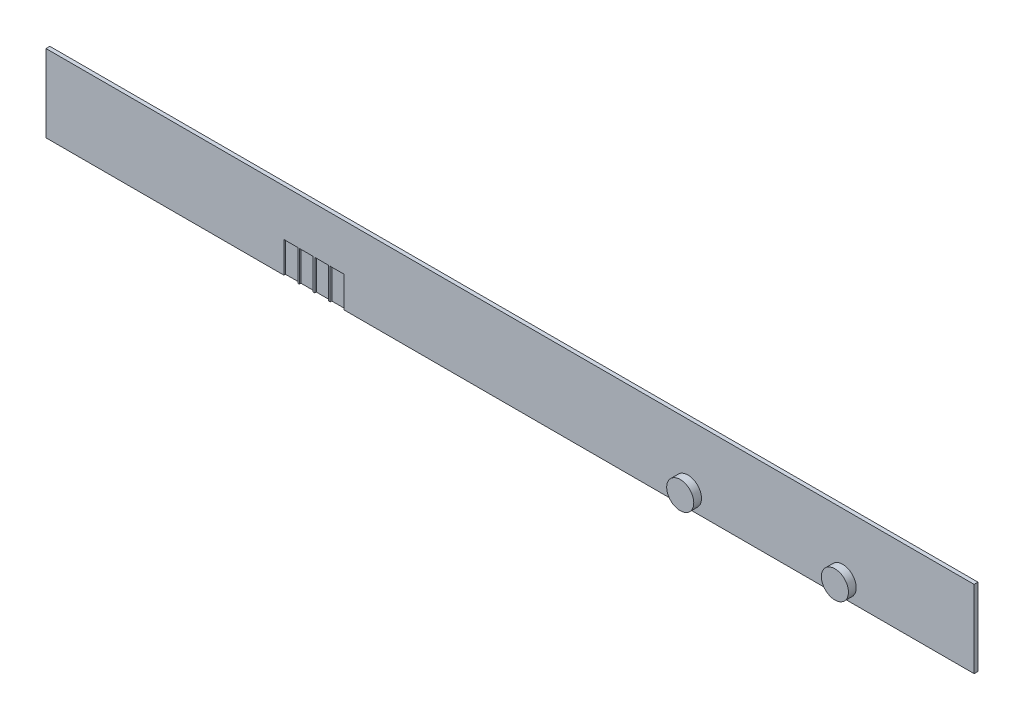
from build123d import *

# Parameters (mm, degrees)
SKETCH1_W           = 120
SKETCH1_H           = 10
BOSS_EXTRUDE1_DEPTH = 0.5
JACKS_R             = 1.75
BOSS_EXTRUDE2_DEPTH = 1
USB_PORT_W          = 1.8
USB_PORT_H          = 4
CUT_EXTRUDE2_DEPTH  = 0.2
LPATTERN1_COUNT     = 4
LPATTERN1_PITCH     = 2


with BuildPart() as part:
    # Sketch1 → Boss-Extrude1 (new body)
    with BuildSketch(Plane.XY):
        Rectangle(SKETCH1_W, SKETCH1_H)
    extrude(amount=BOSS_EXTRUDE1_DEPTH)

    # Jacks → Boss-Extrude2 (add)
    with BuildSketch(Plane.XY.offset(0.5)):
        with Locations(Location((23, -3, 0), (0, 0, 180))):
            Circle(JACKS_R)
        with Locations(Location((43, -3, 0), (0, 0, 180))):
            Circle(JACKS_R)
    extrude(amount=BOSS_EXTRUDE2_DEPTH)

    # usb port → Cut-Extrude2 (cut)
    with BuildSketch(Plane.XY.offset(0.5)):
        with Locations((-28.35, -3)):
            Rectangle(USB_PORT_W, USB_PORT_H)
    cut_extrude2 = extrude(amount=-CUT_EXTRUDE2_DEPTH, mode=Mode.SUBTRACT)

    # LPattern1: Cut-Extrude2 ×4
    with Locations(*[(i * LPATTERN1_PITCH, 0, 0) for i in range(1, LPATTERN1_COUNT)]):
        add(cut_extrude2, mode=Mode.SUBTRACT)


solid = part.part
